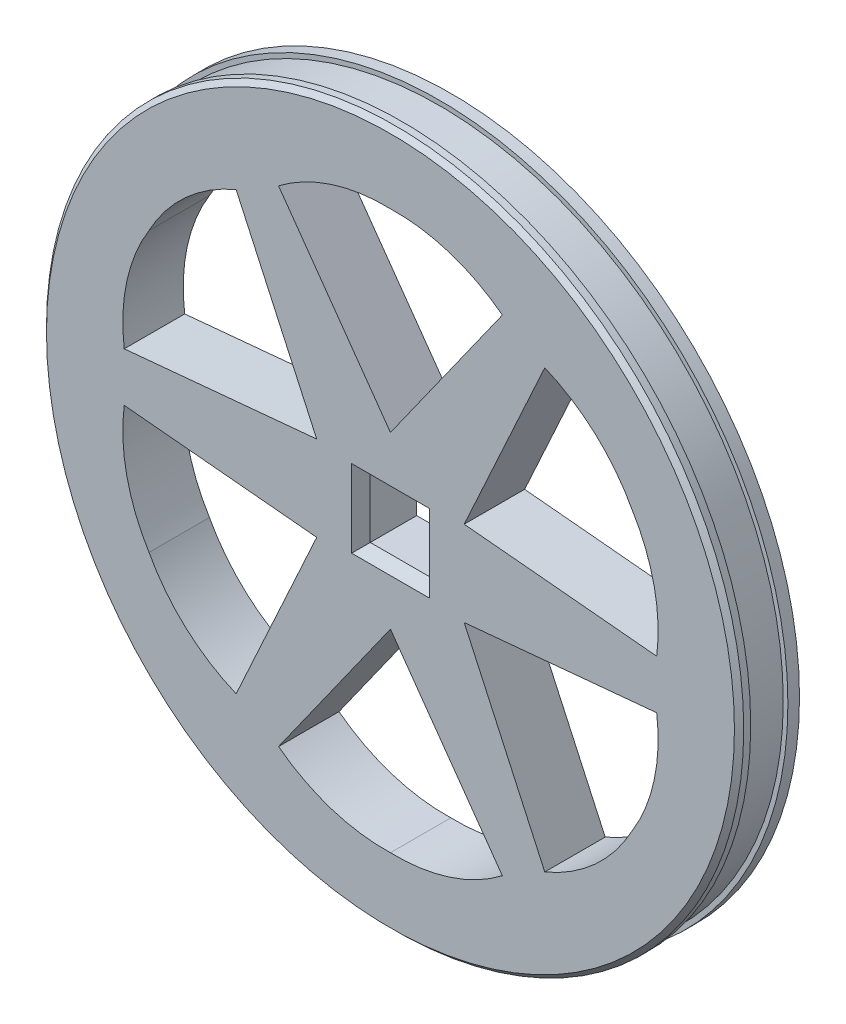
from build123d import *

# Parameters (mm, degrees)
SKETCH1_R           = 37.5
SKETCH1_W           = 7.35
SKETCH1_H           = 7.35
BOSS_EXTRUDE1_DEPTH = 3.25
CUT_EXTRUDE1_DEPTH  = 4
CIRPATTERN1_COUNT   = 6
SKETCH3_R           = 37.5
SKETCH3_R_2         = 37
CUT_EXTRUDE2_DEPTH  = 2
CHAMFER1_SIZE       = 0.5
CHAMFER1_SIZE2      = 1.5
CHAMFER2_SIZE       = 0.5


with BuildPart() as part:
    # Sketch1 → Boss-Extrude1 (new, symmetric)
    with BuildSketch(Plane.XY):
        with Locations(Location((0, 0, 0), (0, 0, 180))):
            Circle(SKETCH1_R)
        Rectangle(SKETCH1_W, SKETCH1_H, mode=Mode.SUBTRACT)
    extrude(amount=BOSS_EXTRUDE1_DEPTH, both=True)

    # Sketch2 → Cut-Extrude1 (cut, symmetric)
    with BuildSketch(Plane.XY):
        with BuildLine():
            Line((0, 9.158641407), (-12.037071564, 26.115211784))
            ThreePointArc((-12.037071564, 26.115211784), (-6.351662121, 29.087034336), (0, 29.988143709))
            ThreePointArc((0, 29.988143709), (6.351662121, 29.087034336), (12.037071564, 26.115211784))
            Line((12.037071564, 26.115211784), (0, 9.158641407))
        make_face()
    cut_extrude1 = extrude(amount=CUT_EXTRUDE1_DEPTH, both=True, mode=Mode.SUBTRACT)

    # CirPattern1: Cut-Extrude1 ×6 about axis
    cirpattern1_axis = Axis((0, 0, 0), (0, 0, 1))
    for i in range(1, CIRPATTERN1_COUNT):
        add(cut_extrude1.rotate(cirpattern1_axis, i * 360 / CIRPATTERN1_COUNT), mode=Mode.SUBTRACT)

    # Sketch3 → Cut-Extrude2 (cut, symmetric)
    with BuildSketch(Plane.XY):
        with Locations(Location((0, 0, 0), (0, 0, 180))):
            Circle(SKETCH3_R)
        Circle(SKETCH3_R_2, mode=Mode.SUBTRACT)
    extrude(amount=CUT_EXTRUDE2_DEPTH, both=True, mode=Mode.SUBTRACT)

    # Chamfer1
    chamfer1_edges = [part.edges().sort_by_distance(p)[0] for p in [
        (3.675, 0, 3.25),
        (0, 3.675, 3.25),
        (-3.675, 0, 3.25),
        (0, -3.675, 3.25),
    ]]
    chamfer1_side = [part.faces().sort_by_distance(p)[0] for p in [
        (36.439339828, 0, 3.25),
    ]]
    chamfer(chamfer1_edges, length=CHAMFER1_SIZE, length2=CHAMFER1_SIZE2, reference=chamfer1_side[0])

    # Chamfer2
    chamfer2_edges = [part.edges().sort_by_distance(p)[0] for p in [
        (37.5, 0, 3.25),
    ]]
    chamfer(chamfer2_edges, length=CHAMFER2_SIZE)


solid = part.part
